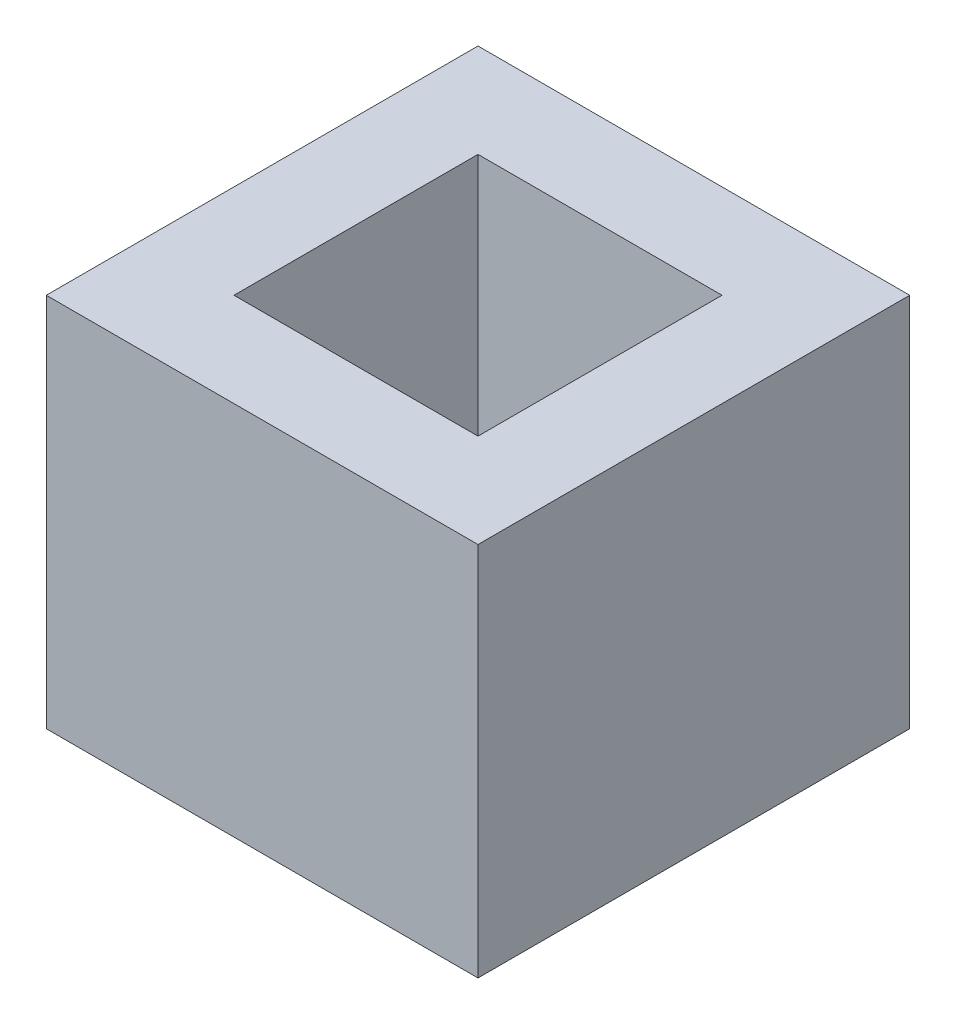
from build123d import *

# Parameters (mm, degrees)
SKETCH_3_W      = 23
SKETCH_3_H      = 23
SKETCH_3_W_2    = 13
SKETCH_3_H_2    = 13
EXTRUDE_3_DEPTH = 20


with BuildPart() as part:
    # 草图3 → 凸台-拉伸3 (new body)
    with BuildSketch(Plane(origin=(0, 0, 0), x_dir=(1, 0, 0), z_dir=(0, 1, 0))):
        with Locations((11.5, -11.5)):
            Rectangle(SKETCH_3_W, SKETCH_3_H)
        with Locations((11.5, -11.5)):
            Rectangle(SKETCH_3_W_2, SKETCH_3_H_2, mode=Mode.SUBTRACT)
    extrude(amount=EXTRUDE_3_DEPTH)


solid = part.part
